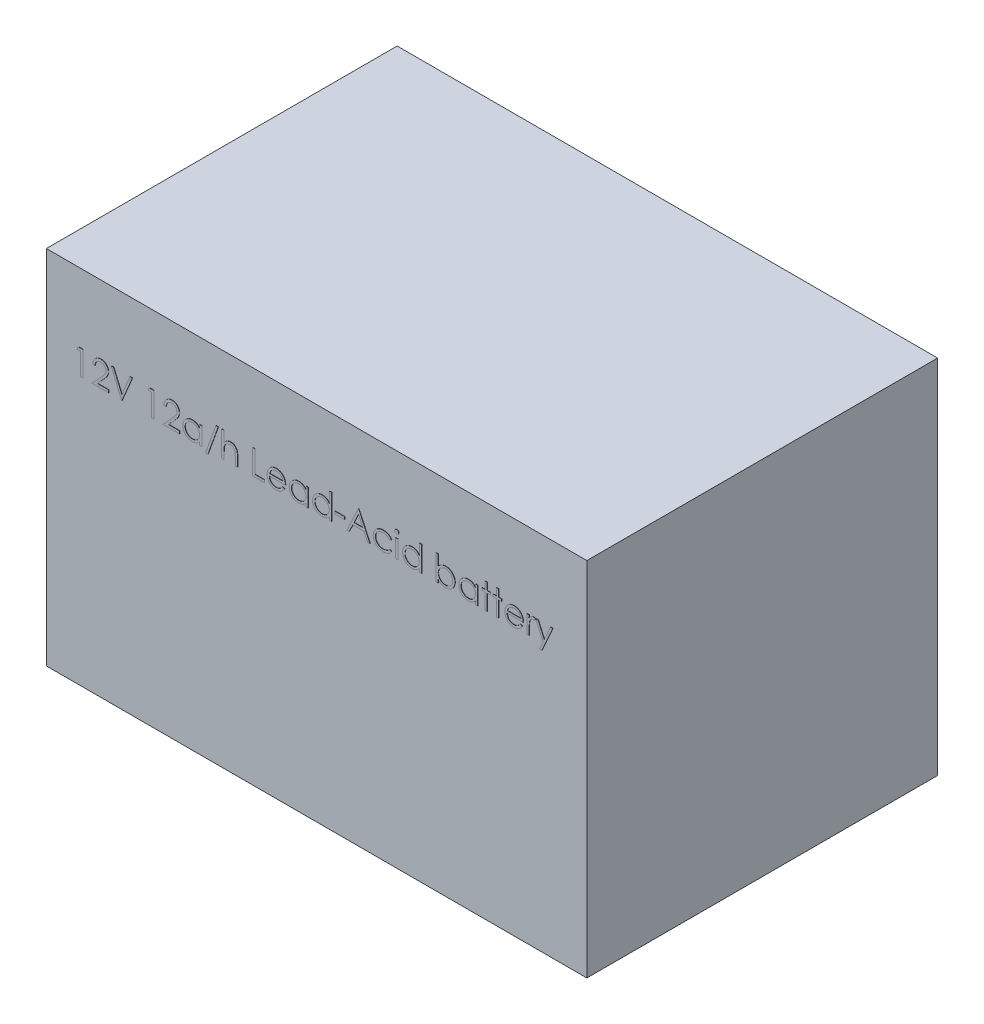
from build123d import *

# Parameters (mm, degrees)
SKETCH1_W           = 151
SKETCH1_H           = 98
BOSS_EXTRUDE1_DEPTH = 101
SKETCH2_W           = 2.645833334
SKETCH2_H           = 0.705555556
SKETCH2_W_2         = 0.617361111
SKETCH2_H_2         = 5.027083333
BOSS_EXTRUDE2_DEPTH = 0.1


with BuildPart() as part:
    # Sketch1 → Boss-Extrude1 (new body)
    with BuildSketch(Plane(origin=(0, 0, 0), x_dir=(1, 0, 0), z_dir=(0, 1, 0))):
        with Locations((45.578534031, -39.693717277)):
            Rectangle(SKETCH1_W, SKETCH1_H)
    extrude(amount=BOSS_EXTRUDE1_DEPTH)

    # Sketch2 → Boss-Extrude2 (add)
    # profile 1 of 25: a face of its own
    with BuildSketch(Plane.XY.offset(88.693717277)):
        Polygon((-20.922839817, 81.744877343), (-19.650910564, 81.744877343), (-19.650910564, 74.865710677), (-20.268271675, 74.865710677), (-20.268271675, 81.039321788), (-21.326605008, 81.039321788), align=None)
    # profile 2 of 25: a face of its own
    with BuildSketch(Plane.XY.offset(88.693717277)):
        with BuildLine():
            Line((-16.21132723, 79.628210677), (-16.828688342, 79.628210677))
            add(Edge.make_bspline(
                [(-16.828688342, 79.628210677), (-16.824664711, 79.710113815), (-16.816762408, 79.870969397), (-16.779755854, 80.105497694), (-16.726804201, 80.329669686), (-16.651936355, 80.541685433), (-16.558956992, 80.743419565), (-16.447455474, 80.934070786), (-16.315387561, 81.112911801), (-16.16560504, 81.278284694), (-16.00292525, 81.429995027), (-15.827396553, 81.56100432), (-15.642946386, 81.671695362), (-15.450134353, 81.764232422), (-15.246785079, 81.833692048), (-15.03474389, 81.885230056), (-14.813079183, 81.916238088), (-14.662051949, 81.919571114), (-14.585242161, 81.921266232)],
                knots=[0, 0, 0, 0, 1.10065271, 2.161652631, 3.183658789, 4.190468796, 5.17591951, 6.163126047, 7.15150782, 8.156236427, 9.156009102, 10.134482811, 11.092018607, 12.041330605, 13.001268258, 13.972401359, 14.968799086, 16, 16, 16, 16], degree=3))
            add(Edge.make_bspline(
                [(-14.585242161, 81.921266232), (-14.50981097, 81.919500338), (-14.361591375, 81.916030417), (-14.145267106, 81.886231775), (-13.939329828, 81.83956038), (-13.744182087, 81.774079723), (-13.561380882, 81.686056997), (-13.389552969, 81.580319216), (-13.226652709, 81.458027619), (-13.080014852, 81.314048992), (-12.945363853, 81.160344068), (-12.829199778, 80.996250581), (-12.72972081, 80.826768973), (-12.64680193, 80.650606877), (-12.585761828, 80.466105605), (-12.539419422, 80.275951282), (-12.513224708, 80.078175612), (-12.509204476, 79.944313798), (-12.507160564, 79.876257552)],
                knots=[0, 0, 0, 0, 1.111607364, 2.184268762, 3.212621178, 4.221274766, 5.211760367, 6.196651075, 7.1921475, 8.207485113, 9.220403448, 10.201281604, 11.166441695, 12.114753415, 13.065576456, 14.026450734, 14.996634279, 16, 16, 16, 16], degree=3))
            add(Edge.make_bspline(
                [(-12.507160564, 79.876257552), (-12.510488632, 79.780444844), (-12.517086364, 79.590500805), (-12.573523788, 79.311373973), (-12.661668538, 79.040937384), (-12.767799057, 78.823285853), (-12.874863349, 78.647899546), (-12.971343676, 78.503498556), (-13.084289394, 78.348018641), (-13.215344394, 78.181980446), (-13.36179767, 78.004083417), (-13.524975756, 77.814435021), (-13.706042266, 77.614994674), (-13.83312701, 77.478776164), (-13.89897914, 77.408191146)],
                knots=[0, 0, 0, 0, 1.184426356, 2.348067706, 3.509069118, 4.696110526, 5.333549288, 6.050745305, 6.844228056, 7.710549037, 8.667450064, 9.695053472, 10.805634456, 12, 12, 12, 12], degree=3))
            Line((-13.89897914, 77.408191146), (-15.620148845, 75.571266232))
            Line((-15.620148845, 75.571266232), (-12.418966119, 75.571266232))
            Line((-12.418966119, 75.571266232), (-12.418966119, 74.865710677))
            Line((-12.418966119, 74.865710677), (-17.093271675, 74.865710677))
            Line((-17.093271675, 74.865710677), (-14.42538973, 77.712737586))
            add(Edge.make_bspline(
                [(-14.42538973, 77.712737586), (-14.360434896, 77.780543187), (-14.235669952, 77.910783868), (-14.059204435, 78.100929852), (-13.900710423, 78.277330438), (-13.759161952, 78.439652332), (-13.63762967, 78.590269854), (-13.529779604, 78.724304921), (-13.443366282, 78.847647299), (-13.349582808, 78.990617243), (-13.258750328, 79.165175738), (-13.180696638, 79.37849612), (-13.13310293, 79.598093375), (-13.127393545, 79.746490831), (-13.124521675, 79.821136024)],
                knots=[0, 0, 0, 0, 1.329631726, 2.553950428, 3.673215718, 4.687767853, 5.603093632, 6.413772471, 7.123043292, 7.734684054, 8.834405432, 9.900288307, 10.943827018, 12, 12, 12, 12], degree=3))
            add(Edge.make_bspline(
                [(-13.124521675, 79.821136024), (-13.125771211, 79.868074344), (-13.128233807, 79.960580759), (-13.149967449, 80.096209935), (-13.18281155, 80.227041492), (-13.229875385, 80.353477861), (-13.29199768, 80.474247828), (-13.367616192, 80.589498399), (-13.454863805, 80.70091921), (-13.555793502, 80.805390752), (-13.666669001, 80.901072502), (-13.78380008, 80.985831865), (-13.907723559, 81.05666588), (-14.037916942, 81.11473292), (-14.174017263, 81.16028358), (-14.316287756, 81.191846335), (-14.464335317, 81.211663217), (-14.565426628, 81.214344465), (-14.616937039, 81.215710677)],
                knots=[0, 0, 0, 0, 0.991446411, 1.95395049, 2.89581595, 3.838931463, 4.798493298, 5.75982156, 6.748411868, 7.785213223, 8.824556874, 9.840280684, 10.836137867, 11.835679398, 12.848801643, 13.863922112, 14.911575587, 16, 16, 16, 16], degree=3))
            add(Edge.make_bspline(
                [(-14.616937039, 81.215710677), (-14.67073376, 81.214305298), (-14.776381635, 81.211545366), (-14.931495115, 81.192239154), (-15.079467519, 81.158932508), (-15.220671068, 81.113379306), (-15.355344683, 81.05547923), (-15.482833417, 80.983362479), (-15.602851072, 80.897307066), (-15.715623263, 80.799739734), (-15.819526155, 80.69111258), (-15.910816383, 80.570019665), (-15.990583297, 80.438671971), (-16.060179302, 80.297423908), (-16.116697926, 80.1449938), (-16.15988563, 79.981922751), (-16.194059064, 79.808918822), (-16.205475573, 79.689447185), (-16.21132723, 79.628210677)],
                knots=[0, 0, 0, 0, 1.031018746, 2.02475058, 2.990194455, 3.934040569, 4.864654155, 5.795059489, 6.735614925, 7.690564532, 8.649604399, 9.611025574, 10.590972636, 11.591080095, 12.624614302, 13.701020113, 14.821632451, 16, 16, 16, 16], degree=3))
        make_face()
    # profile 3 of 25: a face of its own
    with BuildSketch(Plane.XY.offset(88.693717277)):
        Polygon((-11.713410564, 81.744877343), (-11.05195223, 81.744877343), (-8.758896675, 76.323675086), (-6.465841119, 81.744877343), (-5.804382786, 81.744877343), (-8.714799453, 74.865710677), (-8.802993897, 74.865710677), align=None)
    # profile 4 of 25: a face of its own
    with BuildSketch(Plane.XY.offset(88.693717277)):
        Polygon((-1.079089817, 81.744877343), (0.192839436, 81.744877343), (0.192839436, 74.865710677), (-0.424521675, 74.865710677), (-0.424521675, 81.039321788), (-1.482855008, 81.039321788), align=None)
    # profile 5 of 25: a face of its own
    with BuildSketch(Plane.XY.offset(88.693717277)):
        with BuildLine():
            Line((3.63242277, 79.628210677), (3.015061658, 79.628210677))
            add(Edge.make_bspline(
                [(3.015061658, 79.628210677), (3.019085289, 79.710113815), (3.026987592, 79.870969397), (3.063994146, 80.105497694), (3.116945799, 80.329669686), (3.191813645, 80.541685433), (3.284793008, 80.743419565), (3.396294526, 80.934070786), (3.528362439, 81.112911801), (3.67814496, 81.278284694), (3.84082475, 81.429995027), (4.016353447, 81.56100432), (4.200803614, 81.671695362), (4.393615647, 81.764232422), (4.596964921, 81.833692048), (4.80900611, 81.885230056), (5.030670817, 81.916238088), (5.181698051, 81.919571114), (5.258507839, 81.921266232)],
                knots=[0, 0, 0, 0, 1.10065271, 2.161652631, 3.183658789, 4.190468796, 5.17591951, 6.163126047, 7.15150782, 8.156236427, 9.156009102, 10.134482811, 11.092018607, 12.041330605, 13.001268258, 13.972401359, 14.968799086, 16, 16, 16, 16], degree=3))
            add(Edge.make_bspline(
                [(5.258507839, 81.921266232), (5.33393903, 81.919500338), (5.482158625, 81.916030417), (5.698482894, 81.886231775), (5.904420172, 81.83956038), (6.099567913, 81.774079723), (6.282369118, 81.686056997), (6.454197031, 81.580319216), (6.617097291, 81.458027619), (6.763735148, 81.314048992), (6.898386147, 81.160344068), (7.014550222, 80.996250581), (7.11402919, 80.826768973), (7.19694807, 80.650606877), (7.257988172, 80.466105605), (7.304330578, 80.275951282), (7.330525292, 80.078175612), (7.334545524, 79.944313798), (7.336589436, 79.876257552)],
                knots=[0, 0, 0, 0, 1.111607364, 2.184268762, 3.212621178, 4.221274766, 5.211760367, 6.196651075, 7.1921475, 8.207485113, 9.220403448, 10.201281604, 11.166441695, 12.114753415, 13.065576456, 14.026450734, 14.996634279, 16, 16, 16, 16], degree=3))
            add(Edge.make_bspline(
                [(7.336589436, 79.876257552), (7.333261368, 79.780444844), (7.326663636, 79.590500805), (7.270226212, 79.311373973), (7.182081462, 79.040937384), (7.075950943, 78.823285853), (6.968886651, 78.647899546), (6.872406324, 78.503498556), (6.759460606, 78.348018641), (6.628405606, 78.181980446), (6.48195233, 78.004083417), (6.318774244, 77.814435021), (6.137707734, 77.614994674), (6.01062299, 77.478776164), (5.94477086, 77.408191146)],
                knots=[0, 0, 0, 0, 1.184426356, 2.348067706, 3.509069118, 4.696110526, 5.333549288, 6.050745305, 6.844228056, 7.710549037, 8.667450064, 9.695053472, 10.805634456, 12, 12, 12, 12], degree=3))
            Line((5.94477086, 77.408191146), (4.223601155, 75.571266232))
            Line((4.223601155, 75.571266232), (7.424783881, 75.571266232))
            Line((7.424783881, 75.571266232), (7.424783881, 74.865710677))
            Line((7.424783881, 74.865710677), (2.750478325, 74.865710677))
            Line((2.750478325, 74.865710677), (5.41836027, 77.712737586))
            add(Edge.make_bspline(
                [(5.41836027, 77.712737586), (5.483315104, 77.780543187), (5.608080048, 77.910783868), (5.784545565, 78.100929852), (5.943039577, 78.277330438), (6.084588048, 78.439652332), (6.20612033, 78.590269854), (6.313970396, 78.724304921), (6.400383718, 78.847647299), (6.494167192, 78.990617243), (6.584999672, 79.165175738), (6.663053362, 79.37849612), (6.71064707, 79.598093375), (6.716356455, 79.746490831), (6.719228325, 79.821136024)],
                knots=[0, 0, 0, 0, 1.329631726, 2.553950428, 3.673215718, 4.687767853, 5.603093632, 6.413772471, 7.123043292, 7.734684054, 8.834405432, 9.900288307, 10.943827018, 12, 12, 12, 12], degree=3))
            add(Edge.make_bspline(
                [(6.719228325, 79.821136024), (6.717978789, 79.868074344), (6.715516193, 79.960580759), (6.693782551, 80.096209935), (6.66093845, 80.227041492), (6.613874615, 80.353477861), (6.55175232, 80.474247828), (6.476133808, 80.589498399), (6.388886195, 80.70091921), (6.287956498, 80.805390752), (6.177080999, 80.901072502), (6.05994992, 80.985831865), (5.936026441, 81.05666588), (5.805833058, 81.11473292), (5.669732737, 81.16028358), (5.527462244, 81.191846335), (5.379414683, 81.211663217), (5.278323372, 81.214344465), (5.226812961, 81.215710677)],
                knots=[0, 0, 0, 0, 0.991446411, 1.95395049, 2.89581595, 3.838931463, 4.798493298, 5.75982156, 6.748411868, 7.785213223, 8.824556874, 9.840280684, 10.836137867, 11.835679398, 12.848801643, 13.863922112, 14.911575587, 16, 16, 16, 16], degree=3))
            add(Edge.make_bspline(
                [(5.226812961, 81.215710677), (5.17301624, 81.214305298), (5.067368365, 81.211545366), (4.912254885, 81.192239154), (4.764282481, 81.158932508), (4.623078932, 81.113379306), (4.488405317, 81.05547923), (4.360916583, 80.983362479), (4.240898928, 80.897307066), (4.128126737, 80.799739734), (4.024223845, 80.69111258), (3.932933617, 80.570019665), (3.853166703, 80.438671971), (3.783570698, 80.297423908), (3.727052074, 80.1449938), (3.68386437, 79.981922751), (3.649690936, 79.808918822), (3.638274427, 79.689447185), (3.63242277, 79.628210677)],
                knots=[0, 0, 0, 0, 1.031018746, 2.02475058, 2.990194455, 3.934040569, 4.864654155, 5.795059489, 6.735614925, 7.690564532, 8.649604399, 9.611025574, 10.590972636, 11.591080095, 12.624614302, 13.701020113, 14.821632451, 16, 16, 16, 16], degree=3))
        make_face()
    # profile 6 of 25: a face of its own
    with BuildSketch(Plane.XY.offset(88.693717277)):
        with BuildLine():
            Line((13.598394992, 79.89279401), (13.598394992, 74.865710677))
            Line((13.598394992, 74.865710677), (12.981033881, 74.865710677))
            Line((12.981033881, 74.865710677), (12.981033881, 75.735252777))
            add(Edge.make_bspline(
                [(12.981033881, 75.735252777), (12.911419091, 75.656555909), (12.775564954, 75.50297798), (12.548668185, 75.302337901), (12.308156445, 75.136494319), (12.055197062, 75.002547282), (11.790018467, 74.901930514), (11.513208491, 74.830414385), (11.224654217, 74.784434359), (11.027610601, 74.779842963), (10.927756971, 74.777516232)],
                knots=[0, 0, 0, 0, 1.074387032, 2.096679803, 3.090159297, 4.057316773, 5.018401886, 5.985159533, 6.978961417, 8, 8, 8, 8], degree=3))
            add(Edge.make_bspline(
                [(10.927756971, 74.777516232), (10.838980433, 74.779926638), (10.66390917, 74.784680064), (10.406374638, 74.821556925), (10.158543324, 74.880777945), (9.920181039, 74.963133145), (9.692830191, 75.072375927), (9.474544216, 75.203161166), (9.26645396, 75.35890713), (9.071731209, 75.536955743), (8.892416885, 75.730348748), (8.73505836, 75.936616722), (8.603856771, 76.154867726), (8.494143731, 76.382338484), (8.40963544, 76.62078007), (8.350722975, 76.869367933), (8.313889073, 77.127808148), (8.309137612, 77.303795949), (8.306728325, 77.393032725)],
                knots=[0, 0, 0, 0, 1.033919861, 2.038935746, 3.024066025, 3.998881131, 4.97069526, 5.957263378, 6.95902576, 7.993208707, 9.027059324, 10.027763471, 11.009749337, 11.988697705, 12.965288445, 13.950418724, 14.960734635, 16, 16, 16, 16], degree=3))
            add(Edge.make_bspline(
                [(8.306728325, 77.393032725), (8.309191011, 77.480425076), (8.314059607, 77.653195039), (8.350328971, 77.907289242), (8.41131968, 78.152026919), (8.496911937, 78.386620149), (8.60666797, 78.611352795), (8.740179008, 78.826383801), (8.897454692, 79.032305557), (9.078774602, 79.224276028), (9.275194013, 79.401602497), (9.485320578, 79.555713609), (9.70392729, 79.688809463), (9.934404945, 79.794264094), (10.173342195, 79.879583655), (10.42286617, 79.938612739), (10.681938689, 79.973396402), (10.857830121, 79.978433454), (10.947049506, 79.980988455)],
                knots=[0, 0, 0, 0, 1.020392517, 2.01726096, 2.990465484, 3.961182959, 4.928053699, 5.906110375, 6.912531644, 7.948652711, 8.985773172, 9.998621852, 10.987621588, 11.969261332, 12.953316658, 13.946091881, 14.958173133, 16, 16, 16, 16], degree=3))
            add(Edge.make_bspline(
                [(10.947049506, 79.980988455), (11.049647086, 79.978162588), (11.250836098, 79.972621197), (11.545122935, 79.926505766), (11.823521784, 79.848597302), (12.088181707, 79.742623743), (12.338152318, 79.601799872), (12.571067112, 79.424160211), (12.789363675, 79.210825092), (12.915901605, 79.046962469), (12.981033881, 78.962618229)],
                knots=[0, 0, 0, 0, 1.038897134, 2.037228247, 3.008116434, 3.962042015, 4.918381754, 5.904844433, 6.921570401, 8, 8, 8, 8], degree=3))
            Line((12.981033881, 78.962618229), (12.981033881, 79.89279401))
            Line((12.981033881, 79.89279401), (13.598394992, 79.89279401))
        make_face()
        with BuildLine():
            add(Edge.make_bspline(
                [(10.955317735, 79.363627343), (10.865074197, 79.360416467), (10.686947807, 79.354078709), (10.425452989, 79.304600803), (10.175221505, 79.22227763), (9.937504875, 79.109691417), (9.716058178, 78.968120651), (9.518147165, 78.796885646), (9.342153118, 78.600658372), (9.194136518, 78.380324343), (9.073474958, 78.144117166), (8.988631184, 77.897205324), (8.932675556, 77.644042208), (8.926958928, 77.472332929), (8.924089436, 77.386142534)],
                knots=[0, 0, 0, 0, 1.031046209, 2.035121221, 3.029706178, 4.034933723, 5.034054252, 6.02443088, 7.017295772, 8.038157696, 9.050218397, 10.03989886, 11.016116709, 12, 12, 12, 12], degree=3))
            add(Edge.make_bspline(
                [(8.924089436, 77.386142534), (8.92775484, 77.300467217), (8.935071279, 77.129452399), (8.987649132, 76.875944147), (9.075859455, 76.628974119), (9.196229271, 76.390638523), (9.346955006, 76.169357154), (9.521663536, 75.969389366), (9.722044387, 75.797430663), (9.944000713, 75.653483956), (10.181052807, 75.53720143), (10.43034188, 75.456291346), (10.687181735, 75.404053351), (10.861818882, 75.397951575), (10.949805582, 75.394877343)],
                knots=[0, 0, 0, 0, 0.979072187, 1.954306742, 2.945804271, 3.96968567, 4.997920485, 5.998718438, 6.996577872, 8.005894225, 9.015743152, 10.005417472, 10.995077863, 12, 12, 12, 12], degree=3))
            add(Edge.make_bspline(
                [(10.949805582, 75.394877343), (11.039129601, 75.398139963), (11.216786216, 75.40462899), (11.479056819, 75.454318715), (11.733576085, 75.536414293), (11.976876935, 75.650213648), (12.203528045, 75.791251023), (12.40695066, 75.95636496), (12.578961212, 76.148398242), (12.724785019, 76.359444104), (12.839127416, 76.590804231), (12.922416551, 76.837145598), (12.971659407, 77.098476783), (12.977865849, 77.277067668), (12.981033881, 77.368228038)],
                knots=[0, 0, 0, 0, 1.01762866, 2.023962475, 3.030623092, 4.058876274, 5.077231937, 6.066672613, 7.034107872, 8.005628644, 8.981990164, 9.965428785, 10.961468474, 12, 12, 12, 12], degree=3))
            add(Edge.make_bspline(
                [(12.981033881, 77.368228038), (12.979147699, 77.437683702), (12.975435096, 77.57439443), (12.947072155, 77.775123634), (12.901954794, 77.967216945), (12.838379167, 78.150876326), (12.754863559, 78.325086338), (12.654137296, 78.491097848), (12.534429084, 78.648047434), (12.397665952, 78.793773874), (12.24796506, 78.926692076), (12.089558409, 79.045336554), (11.920569229, 79.142802106), (11.743839434, 79.223467748), (11.559062394, 79.287658529), (11.364734545, 79.330481723), (11.162921441, 79.359885878), (11.025247587, 79.362367057), (10.955317735, 79.363627343)],
                knots=[0, 0, 0, 0, 1.050140795, 2.067009409, 3.05949893, 4.030605086, 5.00011959, 5.97591094, 6.962425594, 7.979863591, 8.993523472, 9.986985069, 10.967611495, 11.937549037, 12.921786183, 13.919465291, 14.943216303, 16, 16, 16, 16], degree=3))
        make_face(mode=Mode.SUBTRACT)
    # profile 7 of 25: a face of its own
    with BuildSketch(Plane.XY.offset(88.693717277)):
        Polygon((18.184506103, 81.921266232), (15.307162353, 73.895571788), (14.656728325, 73.895571788), (17.534072075, 81.921266232), align=None)
    # profile 8 of 25: a face of its own
    with BuildSketch(Plane.XY.offset(88.693717277)):
        with BuildLine():
            Line((19.154644992, 81.921266232), (19.772006103, 81.921266232))
            Line((19.772006103, 81.921266232), (19.772006103, 78.943325694))
            add(Edge.make_bspline(
                [(19.772006103, 78.943325694), (19.838276656, 79.026158687), (19.96730882, 79.18743877), (20.184486306, 79.397864992), (20.407510604, 79.580258472), (20.644084772, 79.725449097), (20.889868592, 79.840147493), (21.145898684, 79.921493927), (21.412222617, 79.971517452), (21.593095858, 79.977803866), (21.684723117, 79.980988455)],
                knots=[0, 0, 0, 0, 1.125788106, 2.19196713, 3.20547328, 4.180437432, 5.132270164, 6.079753143, 7.027236121, 8, 8, 8, 8], degree=3))
            add(Edge.make_bspline(
                [(21.684723117, 79.980988455), (21.777749877, 79.977557853), (21.959825686, 79.970843338), (22.224931989, 79.917749181), (22.47250509, 79.827027835), (22.701809026, 79.702874551), (22.907839473, 79.548244983), (23.090333473, 79.369717788), (23.239396758, 79.162804408), (23.340813594, 78.971649556), (23.406801327, 78.801559696), (23.448571286, 78.655649599), (23.483987591, 78.493061648), (23.514845048, 78.313879537), (23.535410969, 78.117243135), (23.551930045, 77.90403957), (23.563676624, 77.674281068), (23.564131837, 77.515234244), (23.564367214, 77.432995833)],
                knots=[0, 0, 0, 0, 1.235656852, 2.418478516, 3.575258207, 4.727955599, 5.870717718, 6.98870536, 8.107142894, 9.245821548, 9.854588956, 10.528768408, 11.260415777, 12.065282286, 12.943670737, 13.886611085, 14.907229059, 16, 16, 16, 16], degree=3))
            Line((23.564367214, 77.432995833), (23.564367214, 74.865710677))
            Line((23.564367214, 74.865710677), (22.947006103, 74.865710677))
            Line((22.947006103, 74.865710677), (22.947006103, 77.230424218))
            add(Edge.make_bspline(
                [(22.947006103, 77.230424218), (22.946632067, 77.298867346), (22.945916599, 77.429787402), (22.943551454, 77.617227217), (22.938271761, 77.78723331), (22.929739971, 77.939260833), (22.920766969, 78.073521732), (22.908417258, 78.189821031), (22.894049167, 78.288318463), (22.881138384, 78.347606322), (22.875348117, 78.37419592)],
                knots=[0, 0, 0, 0, 1.430932559, 2.737130458, 3.918967929, 4.986496826, 5.920444988, 6.731744033, 7.431208747, 8, 8, 8, 8], degree=3))
            add(Edge.make_bspline(
                [(22.875348117, 78.37419592), (22.852894035, 78.45221405), (22.809726194, 78.602203451), (22.70939261, 78.80594945), (22.584075792, 78.979667553), (22.431068853, 79.121013374), (22.253078544, 79.231888912), (22.048944258, 79.308675707), (21.820587237, 79.356334028), (21.659710118, 79.36112842), (21.575858099, 79.363627343)],
                knots=[0, 0, 0, 0, 1.090059168, 2.095632401, 3.037101401, 3.955032261, 4.878929692, 5.839099886, 6.873700383, 8, 8, 8, 8], degree=3))
            add(Edge.make_bspline(
                [(21.575858099, 79.363627343), (21.526194893, 79.362692118), (21.42791269, 79.360841331), (21.282175253, 79.342259919), (21.140800391, 79.31189583), (21.002426587, 79.270808457), (20.869986516, 79.214899433), (20.739619773, 79.15017593), (20.615019964, 79.070951014), (20.493974508, 78.982060845), (20.381318261, 78.883649924), (20.276505085, 78.779780493), (20.183069609, 78.66917339), (20.098419319, 78.553603162), (20.025346284, 78.431484601), (19.961560524, 78.303995328), (19.907439768, 78.170967682), (19.880546762, 78.078639317), (19.867090738, 78.032442448)],
                knots=[0, 0, 0, 0, 1.024319606, 2.027102035, 3.025350316, 4.005802111, 5.00026367, 5.987881639, 7.005602596, 8.042517216, 9.083927026, 10.089214625, 11.084353441, 12.06828073, 13.041928858, 14.016821737, 15.00770877, 16, 16, 16, 16], degree=3))
            add(Edge.make_bspline(
                [(19.867090738, 78.032442448), (19.859347888, 77.998988174), (19.842475264, 77.926087194), (19.824167181, 77.805850516), (19.80777944, 77.666131945), (19.793925683, 77.507143396), (19.78542876, 77.328302276), (19.776273099, 77.130828998), (19.772864935, 76.9134866), (19.772300936, 76.762350311), (19.772006103, 76.683343055)],
                knots=[0, 0, 0, 0, 0.607992626, 1.324890765, 2.152360218, 3.099583803, 4.150613268, 5.323148443, 6.60066238, 8, 8, 8, 8], degree=3))
            Line((19.772006103, 76.683343055), (19.772006103, 74.865710677))
            Line((19.772006103, 74.865710677), (19.154644992, 74.865710677))
            Line((19.154644992, 74.865710677), (19.154644992, 81.921266232))
        make_face()
    # profile 9 of 25: a face of its own
    with BuildSketch(Plane.XY.offset(88.693717277)):
        Polygon((27.797700547, 81.744877343), (28.415061658, 81.744877343), (28.415061658, 75.571266232), (31.060894992, 75.571266232), (31.060894992, 74.865710677), (27.797700547, 74.865710677), align=None)
    # profile 10 of 25: a face of its own
    with BuildSketch(Plane.XY.offset(88.693717277)):
        with BuildLine():
            Line((36.156880235, 76.453210677), (36.705339436, 76.165200694))
            add(Edge.make_bspline(
                [(36.705339436, 76.165200694), (36.661633938, 76.087675766), (36.576600345, 75.936842955), (36.430367447, 75.729619144), (36.277075885, 75.543198217), (36.109806062, 75.382560527), (35.933562443, 75.242517626), (35.747367666, 75.119994116), (35.550252382, 75.015590929), (35.342207269, 74.927630901), (35.121485175, 74.85999986), (34.887551218, 74.812230492), (34.639957243, 74.782702615), (34.470245882, 74.779272583), (34.383345079, 74.777516232)],
                knots=[0, 0, 0, 0, 1.120438281, 2.179929193, 3.190490725, 4.156257408, 5.095198341, 6.022838206, 6.959905092, 7.901321166, 8.864066838, 9.862729781, 10.905609505, 12, 12, 12, 12], degree=3))
            add(Edge.make_bspline(
                [(34.383345079, 74.777516232), (34.286757692, 74.779770978), (34.098343682, 74.784169334), (33.824081631, 74.822088213), (33.565858512, 74.883946385), (33.323688843, 74.97035961), (33.098165677, 75.083231648), (32.888840783, 75.220735344), (32.694613358, 75.382164335), (32.521603871, 75.568916893), (32.365851906, 75.768770359), (32.228414372, 75.977024127), (32.113517683, 76.193154226), (32.02005416, 76.415784744), (31.944570312, 76.643512469), (31.891960993, 76.878409413), (31.861634191, 77.119839829), (31.856986929, 77.283165664), (31.854644992, 77.365471961)],
                knots=[0, 0, 0, 0, 1.145258523, 2.234067595, 3.276747158, 4.290159414, 5.277019952, 6.260822364, 7.254936242, 8.264827045, 9.274100331, 10.257902744, 11.220704747, 12.172965371, 13.118907548, 14.062713208, 15.023725156, 16, 16, 16, 16], degree=3))
            add(Edge.make_bspline(
                [(31.854644992, 77.365471961), (31.856726709, 77.442705015), (31.860852397, 77.595770728), (31.886857195, 77.822322411), (31.932944256, 78.042511668), (31.996186055, 78.256521458), (32.07785404, 78.463993457), (32.177763557, 78.665053934), (32.296070242, 78.859488941), (32.387411176, 78.982140815), (32.433421033, 79.043922482)],
                knots=[0, 0, 0, 0, 1.024358464, 2.0301432, 3.019427413, 4.004406732, 4.986367066, 5.972626655, 6.978780325, 8, 8, 8, 8], degree=3))
            add(Edge.make_bspline(
                [(32.433421033, 79.043922482), (32.495741729, 79.118352845), (32.618408959, 79.264855805), (32.825877462, 79.457351252), (33.050531776, 79.618606339), (33.289556532, 79.752272746), (33.545729768, 79.853836069), (33.815607911, 79.929521805), (34.102263938, 79.971932872), (34.298232175, 79.977923316), (34.398503499, 79.980988455)],
                knots=[0, 0, 0, 0, 1.030682036, 2.02871468, 2.997146059, 3.962720338, 4.930598197, 5.918074684, 6.934738563, 8, 8, 8, 8], degree=3))
            add(Edge.make_bspline(
                [(34.398503499, 79.980988455), (34.501588018, 79.978327104), (34.703816347, 79.97310614), (34.998700909, 79.924703668), (35.277721317, 79.847946802), (35.540765918, 79.73954334), (35.78786138, 79.599680935), (36.017401579, 79.426440244), (36.233312112, 79.225139932), (36.358922902, 79.070332719), (36.422841606, 78.991557031)],
                knots=[0, 0, 0, 0, 1.056321875, 2.072262726, 3.055038591, 4.01806755, 4.982017516, 5.957941055, 6.960871419, 8, 8, 8, 8], degree=3))
            add(Edge.make_bspline(
                [(36.422841606, 78.991557031), (36.466331577, 78.932192611), (36.553022035, 78.813858918), (36.661608895, 78.620905846), (36.755868013, 78.419030618), (36.831210535, 78.204970023), (36.892217936, 77.981260348), (36.936356278, 77.746302322), (36.96224085, 77.500165913), (36.967328873, 77.3324586), (36.96992277, 77.246960677)],
                knots=[0, 0, 0, 0, 0.94817472, 1.890038105, 2.849395472, 3.817997239, 4.812318967, 5.836947057, 6.897266129, 8, 8, 8, 8], degree=3))
            Line((36.96992277, 77.246960677), (32.472006103, 77.246960677))
            add(Edge.make_bspline(
                [(32.472006103, 77.246960677), (32.475032163, 77.180723217), (32.480982787, 77.050469923), (32.508725765, 76.859876158), (32.5524552, 76.678318553), (32.613913798, 76.507158907), (32.688340181, 76.344161716), (32.779510203, 76.190536094), (32.888278779, 76.046981781), (33.009599171, 75.912214705), (33.144641331, 75.792201232), (33.28671135, 75.684784467), (33.437843821, 75.594754658), (33.596847078, 75.52167847), (33.763464003, 75.464470698), (33.937747091, 75.42542097), (34.119353389, 75.399266168), (34.24315035, 75.396357921), (34.30617494, 75.394877343)],
                knots=[0, 0, 0, 0, 1.094153842, 2.151609401, 3.174256925, 4.172055639, 5.149267565, 6.128595816, 7.11444997, 8.118368179, 9.117203808, 10.09244225, 11.054858984, 12.015122123, 12.976791628, 13.957293641, 14.960065497, 16, 16, 16, 16], degree=3))
            add(Edge.make_bspline(
                [(34.30617494, 75.394877343), (34.367794874, 75.396072464), (34.490060644, 75.398443813), (34.672144043, 75.421502605), (34.851276614, 75.45878823), (35.026716952, 75.509674389), (35.194904412, 75.57173794), (35.350659654, 75.6466282), (35.493903982, 75.729472523), (35.627786258, 75.824227492), (35.757647223, 75.940206678), (35.886469419, 76.084935935), (36.024596508, 76.256104397), (36.111057005, 76.384932843), (36.156880235, 76.453210677)],
                knots=[0, 0, 0, 0, 0.99110716, 1.966546729, 2.947904876, 3.932708344, 4.903319531, 5.828989031, 6.710028674, 7.56322171, 8.463672341, 9.504779593, 10.677557249, 12, 12, 12, 12], degree=3))
        make_face()
        with BuildLine():
            add(Edge.make_bspline(
                [(36.352561658, 77.864321788), (36.329965317, 77.946209174), (36.286474632, 78.103816033), (36.195598159, 78.32206426), (36.093252785, 78.516032979), (35.97213674, 78.68423771), (35.834909697, 78.833620806), (35.67640351, 78.964164953), (35.498653915, 79.080948539), (35.302579699, 79.179522082), (35.094943286, 79.263427983), (34.877549449, 79.319689967), (34.655730154, 79.358232055), (34.505696932, 79.361821228), (34.430198377, 79.363627343)],
                knots=[0, 0, 0, 0, 1.154881502, 2.222775134, 3.210006277, 4.132804581, 5.035138423, 5.962687519, 6.919655026, 7.923214229, 8.944639381, 9.960483929, 10.97369054, 12, 12, 12, 12], degree=3))
            add(Edge.make_bspline(
                [(34.430198377, 79.363627343), (34.368581802, 79.362425118), (34.246778788, 79.36004857), (34.067328712, 79.337504304), (33.894996351, 79.30023918), (33.728510125, 79.249205676), (33.570051728, 79.181183292), (33.416361773, 79.101417926), (33.271348161, 79.004045123), (33.180658543, 78.929830993), (33.134842474, 78.892338281)],
                knots=[0, 0, 0, 0, 1.04873581, 2.073130211, 3.073294108, 4.04793562, 5.032784715, 6.005352987, 6.992311501, 8, 8, 8, 8], degree=3))
            add(Edge.make_bspline(
                [(33.134842474, 78.892338281), (33.102032226, 78.862670763), (33.03563228, 78.802630937), (32.94690966, 78.699189485), (32.86196085, 78.587645641), (32.784651492, 78.463731949), (32.713741855, 78.328859442), (32.647387423, 78.184165733), (32.587663654, 78.02855283), (32.554061657, 77.920112714), (32.536773898, 77.864321788)],
                knots=[0, 0, 0, 0, 0.879870761, 1.780643979, 2.707998968, 3.669668524, 4.684282772, 5.740141944, 6.837334558, 8, 8, 8, 8], degree=3))
            Line((32.536773898, 77.864321788), (36.352561658, 77.864321788))
        make_face(mode=Mode.SUBTRACT)
    # profile 11 of 25: a face of its own
    with BuildSketch(Plane.XY.offset(88.693717277)):
        with BuildLine():
            Line((43.31992277, 79.89279401), (43.31992277, 74.865710677))
            Line((43.31992277, 74.865710677), (42.702561658, 74.865710677))
            Line((42.702561658, 74.865710677), (42.702561658, 75.735252777))
            add(Edge.make_bspline(
                [(42.702561658, 75.735252777), (42.632946869, 75.656555909), (42.497092731, 75.50297798), (42.270195963, 75.302337901), (42.029684222, 75.136494319), (41.77672484, 75.002547282), (41.511546245, 74.901930514), (41.234736269, 74.830414385), (40.946181995, 74.784434359), (40.749138379, 74.779842963), (40.649284749, 74.777516232)],
                knots=[0, 0, 0, 0, 1.074387032, 2.096679803, 3.090159297, 4.057316773, 5.018401886, 5.985159533, 6.978961417, 8, 8, 8, 8], degree=3))
            add(Edge.make_bspline(
                [(40.649284749, 74.777516232), (40.560508211, 74.779926638), (40.385436947, 74.784680064), (40.127902416, 74.821556925), (39.880071102, 74.880777945), (39.641708817, 74.963133145), (39.414357969, 75.072375927), (39.196071993, 75.203161166), (38.987981738, 75.35890713), (38.793258987, 75.536955743), (38.613944663, 75.730348748), (38.456586137, 75.936616722), (38.325384548, 76.154867726), (38.215671509, 76.382338484), (38.131163217, 76.62078007), (38.072250753, 76.869367933), (38.035416851, 77.127808148), (38.03066539, 77.303795949), (38.028256103, 77.393032725)],
                knots=[0, 0, 0, 0, 1.033919861, 2.038935746, 3.024066025, 3.998881131, 4.97069526, 5.957263378, 6.95902576, 7.993208707, 9.027059324, 10.027763471, 11.009749337, 11.988697705, 12.965288445, 13.950418724, 14.960734635, 16, 16, 16, 16], degree=3))
            add(Edge.make_bspline(
                [(38.028256103, 77.393032725), (38.030718788, 77.480425076), (38.035587385, 77.653195039), (38.071856749, 77.907289242), (38.132847457, 78.152026919), (38.218439715, 78.386620149), (38.328195748, 78.611352795), (38.461706786, 78.826383801), (38.61898247, 79.032305557), (38.80030238, 79.224276028), (38.996721791, 79.401602497), (39.206848356, 79.555713609), (39.425455067, 79.688809463), (39.655932723, 79.794264094), (39.894869973, 79.879583655), (40.144393948, 79.938612739), (40.403466467, 79.973396402), (40.579357899, 79.978433454), (40.668577283, 79.980988455)],
                knots=[0, 0, 0, 0, 1.020392517, 2.01726096, 2.990465484, 3.961182959, 4.928053699, 5.906110375, 6.912531644, 7.948652711, 8.985773172, 9.998621852, 10.987621588, 11.969261332, 12.953316658, 13.946091881, 14.958173133, 16, 16, 16, 16], degree=3))
            add(Edge.make_bspline(
                [(40.668577283, 79.980988455), (40.771174864, 79.978162588), (40.972363876, 79.972621197), (41.266650713, 79.926505766), (41.545049562, 79.848597302), (41.809709485, 79.742623743), (42.059680095, 79.601799872), (42.29259489, 79.424160211), (42.510891453, 79.210825092), (42.637429383, 79.046962469), (42.702561658, 78.962618229)],
                knots=[0, 0, 0, 0, 1.038897134, 2.037228247, 3.008116434, 3.962042015, 4.918381754, 5.904844433, 6.921570401, 8, 8, 8, 8], degree=3))
            Line((42.702561658, 78.962618229), (42.702561658, 79.89279401))
            Line((42.702561658, 79.89279401), (43.31992277, 79.89279401))
        make_face()
        with BuildLine():
            add(Edge.make_bspline(
                [(40.676845513, 79.363627343), (40.586601975, 79.360416467), (40.408475585, 79.354078709), (40.146980766, 79.304600803), (39.896749282, 79.22227763), (39.659032653, 79.109691417), (39.437585956, 78.968120651), (39.239674943, 78.796885646), (39.063680896, 78.600658372), (38.915664295, 78.380324343), (38.795002735, 78.144117166), (38.710158962, 77.897205324), (38.654203334, 77.644042208), (38.648486706, 77.472332929), (38.645617214, 77.386142534)],
                knots=[0, 0, 0, 0, 1.031046209, 2.035121221, 3.029706178, 4.034933723, 5.034054252, 6.02443088, 7.017295772, 8.038157696, 9.050218397, 10.03989886, 11.016116709, 12, 12, 12, 12], degree=3))
            add(Edge.make_bspline(
                [(38.645617214, 77.386142534), (38.649282617, 77.300467217), (38.656599057, 77.129452399), (38.70917691, 76.875944147), (38.797387233, 76.628974119), (38.917757049, 76.390638523), (39.068482784, 76.169357154), (39.243191314, 75.969389366), (39.443572165, 75.797430663), (39.665528491, 75.653483956), (39.902580585, 75.53720143), (40.151869658, 75.456291346), (40.408709513, 75.404053351), (40.58334666, 75.397951575), (40.67133336, 75.394877343)],
                knots=[0, 0, 0, 0, 0.979072187, 1.954306742, 2.945804271, 3.96968567, 4.997920485, 5.998718438, 6.996577872, 8.005894225, 9.015743152, 10.005417472, 10.995077863, 12, 12, 12, 12], degree=3))
            add(Edge.make_bspline(
                [(40.67133336, 75.394877343), (40.760657379, 75.398139963), (40.938313994, 75.40462899), (41.200584597, 75.454318715), (41.455103863, 75.536414293), (41.698404713, 75.650213648), (41.925055823, 75.791251023), (42.128478437, 75.95636496), (42.30048899, 76.148398242), (42.446312797, 76.359444104), (42.560655194, 76.590804231), (42.643944329, 76.837145598), (42.693187184, 77.098476783), (42.699393627, 77.277067668), (42.702561658, 77.368228038)],
                knots=[0, 0, 0, 0, 1.01762866, 2.023962475, 3.030623092, 4.058876274, 5.077231937, 6.066672613, 7.034107872, 8.005628644, 8.981990164, 9.965428785, 10.961468474, 12, 12, 12, 12], degree=3))
            add(Edge.make_bspline(
                [(42.702561658, 77.368228038), (42.700675477, 77.437683702), (42.696962874, 77.57439443), (42.668599933, 77.775123634), (42.623482572, 77.967216945), (42.559906945, 78.150876326), (42.476391337, 78.325086338), (42.375665073, 78.491097848), (42.255956862, 78.648047434), (42.11919373, 78.793773874), (41.969492838, 78.926692076), (41.811086187, 79.045336554), (41.642097007, 79.142802106), (41.465367212, 79.223467748), (41.280590172, 79.287658529), (41.086262323, 79.330481723), (40.884449219, 79.359885878), (40.746775365, 79.362367057), (40.676845513, 79.363627343)],
                knots=[0, 0, 0, 0, 1.050140795, 2.067009409, 3.05949893, 4.030605086, 5.00011959, 5.97591094, 6.962425594, 7.979863591, 8.993523472, 9.986985069, 10.967611495, 11.937549037, 12.921786183, 13.919465291, 14.943216303, 16, 16, 16, 16], degree=3))
        make_face(mode=Mode.SUBTRACT)
    # profile 12 of 25: a face of its own
    with BuildSketch(Plane.XY.offset(88.693717277)):
        with BuildLine():
            Line((49.846311658, 81.921266232), (49.846311658, 74.865710677))
            Line((49.846311658, 74.865710677), (49.228950547, 74.865710677))
            Line((49.228950547, 74.865710677), (49.228950547, 75.735252777))
            add(Edge.make_bspline(
                [(49.228950547, 75.735252777), (49.159335758, 75.656555909), (49.02348162, 75.50297798), (48.796584851, 75.302337901), (48.556073111, 75.136494319), (48.303113729, 75.002547282), (48.037935134, 74.901930514), (47.761125158, 74.830414385), (47.472570884, 74.784434359), (47.275527268, 74.779842963), (47.175673638, 74.777516232)],
                knots=[0, 0, 0, 0, 1.074387032, 2.096679803, 3.090159297, 4.057316773, 5.018401886, 5.985159533, 6.978961417, 8, 8, 8, 8], degree=3))
            add(Edge.make_bspline(
                [(47.175673638, 74.777516232), (47.0868971, 74.779926638), (46.911825836, 74.784680064), (46.654291305, 74.821556925), (46.406459991, 74.880777945), (46.168097706, 74.963133145), (45.940746858, 75.072375927), (45.722460882, 75.203161166), (45.514370627, 75.35890713), (45.319647876, 75.536955743), (45.140333551, 75.730348748), (44.982975026, 75.936616722), (44.851773437, 76.154867726), (44.742060398, 76.382338484), (44.657552106, 76.62078007), (44.598639642, 76.869367933), (44.56180574, 77.127808148), (44.557054279, 77.303795949), (44.554644992, 77.393032725)],
                knots=[0, 0, 0, 0, 1.033919861, 2.038935746, 3.024066025, 3.998881131, 4.97069526, 5.957263378, 6.95902576, 7.993208707, 9.027059324, 10.027763471, 11.009749337, 11.988697705, 12.965288445, 13.950418724, 14.960734635, 16, 16, 16, 16], degree=3))
            add(Edge.make_bspline(
                [(44.554644992, 77.393032725), (44.557107677, 77.480425076), (44.561976273, 77.653195039), (44.598245638, 77.907289242), (44.659236346, 78.152026919), (44.744828604, 78.386620149), (44.854584637, 78.611352795), (44.988095675, 78.826383801), (45.145371359, 79.032305557), (45.326691269, 79.224276028), (45.52311068, 79.401602497), (45.733237245, 79.555713609), (45.951843956, 79.688809463), (46.182321612, 79.794264094), (46.421258862, 79.879583655), (46.670782837, 79.938612739), (46.929855356, 79.973396402), (47.105746787, 79.978433454), (47.194966172, 79.980988455)],
                knots=[0, 0, 0, 0, 1.020392517, 2.01726096, 2.990465484, 3.961182959, 4.928053699, 5.906110375, 6.912531644, 7.948652711, 8.985773172, 9.998621852, 10.987621588, 11.969261332, 12.953316658, 13.946091881, 14.958173133, 16, 16, 16, 16], degree=3))
            add(Edge.make_bspline(
                [(47.194966172, 79.980988455), (47.297597065, 79.977908365), (47.499050101, 79.97186249), (47.793672076, 79.921337238), (48.072352248, 79.836501629), (48.336695013, 79.720359123), (48.585124443, 79.569409075), (48.819461566, 79.387108312), (49.035631169, 79.168297457), (49.163528287, 79.003960901), (49.228950547, 78.919899045)],
                knots=[0, 0, 0, 0, 1.031072012, 2.023879775, 2.993683497, 3.952812103, 4.918022106, 5.908088563, 6.929940113, 8, 8, 8, 8], degree=3))
            Line((49.228950547, 78.919899045), (49.228950547, 81.921266232))
            Line((49.228950547, 81.921266232), (49.846311658, 81.921266232))
        make_face()
        with BuildLine():
            add(Edge.make_bspline(
                [(47.203234401, 79.363627343), (47.112990864, 79.360416467), (46.934864474, 79.354078709), (46.673369655, 79.304600803), (46.423138171, 79.22227763), (46.185421542, 79.109691417), (45.963974845, 78.968120651), (45.766063832, 78.796885646), (45.590069785, 78.600658372), (45.442053184, 78.380324343), (45.321391624, 78.144117166), (45.236547851, 77.897205324), (45.180592223, 77.644042208), (45.174875595, 77.472332929), (45.172006103, 77.386142534)],
                knots=[0, 0, 0, 0, 1.031046209, 2.035121221, 3.029706178, 4.034933723, 5.034054252, 6.02443088, 7.017295772, 8.038157696, 9.050218397, 10.03989886, 11.016116709, 12, 12, 12, 12], degree=3))
            add(Edge.make_bspline(
                [(45.172006103, 77.386142534), (45.175671506, 77.300467217), (45.182987946, 77.129452399), (45.235565799, 76.875944147), (45.323776122, 76.628974119), (45.444145938, 76.390638523), (45.594871673, 76.169357154), (45.769580203, 75.969389366), (45.969961053, 75.797430663), (46.19191738, 75.653483956), (46.428969474, 75.53720143), (46.678258546, 75.456291346), (46.935098402, 75.404053351), (47.109735549, 75.397951575), (47.197722249, 75.394877343)],
                knots=[0, 0, 0, 0, 0.979072187, 1.954306742, 2.945804271, 3.96968567, 4.997920485, 5.998718438, 6.996577872, 8.005894225, 9.015743152, 10.005417472, 10.995077863, 12, 12, 12, 12], degree=3))
            add(Edge.make_bspline(
                [(47.197722249, 75.394877343), (47.287046268, 75.398139963), (47.464702883, 75.40462899), (47.726973486, 75.454318715), (47.981492752, 75.536414293), (48.224793602, 75.650213648), (48.451444712, 75.791251023), (48.654867326, 75.95636496), (48.826877878, 76.148398242), (48.972701686, 76.359444104), (49.087044083, 76.590804231), (49.170333218, 76.837145598), (49.219576073, 77.098476783), (49.225782516, 77.277067668), (49.228950547, 77.368228038)],
                knots=[0, 0, 0, 0, 1.01762866, 2.023962475, 3.030623092, 4.058876274, 5.077231937, 6.066672613, 7.034107872, 8.005628644, 8.981990164, 9.965428785, 10.961468474, 12, 12, 12, 12], degree=3))
            add(Edge.make_bspline(
                [(49.228950547, 77.368228038), (49.227064366, 77.437683702), (49.223351763, 77.57439443), (49.194988822, 77.775123634), (49.149871461, 77.967216945), (49.086295834, 78.150876326), (49.002780226, 78.325086338), (48.902053962, 78.491097848), (48.782345751, 78.648047434), (48.645582619, 78.793773874), (48.495881726, 78.926692076), (48.337475076, 79.045336554), (48.168485896, 79.142802106), (47.991756101, 79.223467748), (47.806979061, 79.287658529), (47.612651212, 79.330481723), (47.410838108, 79.359885878), (47.273164254, 79.362367057), (47.203234401, 79.363627343)],
                knots=[0, 0, 0, 0, 1.050140795, 2.067009409, 3.05949893, 4.030605086, 5.00011959, 5.97591094, 6.962425594, 7.979863591, 8.993523472, 9.986985069, 10.967611495, 11.937549037, 12.921786183, 13.919465291, 14.943216303, 16, 16, 16, 16], degree=3))
        make_face(mode=Mode.SUBTRACT)
    # profile 13 of 25: a face of its own
    with BuildSketch(Plane.XY.offset(88.693717277)):
        with Locations((52.139367214, 77.51154401)):
            Rectangle(SKETCH2_W, SKETCH2_H)
    # profile 14 of 25: a face of its own
    with BuildSketch(Plane.XY.offset(88.693717277)):
        Polygon((57.431033881, 81.744877343), (60.606033881, 74.865710677), (59.93492928, 74.865710677), (58.917937092, 77.070571788), (55.799436658, 77.070571788), (54.753505669, 74.865710677), (54.079644992, 74.865710677), (57.342839436, 81.744877343), align=None)
        Polygon((57.380046467, 80.40404618), (56.13429994, 77.776127343), (58.592720079, 77.776127343), align=None, mode=Mode.SUBTRACT)
    # profile 15 of 25: a face of its own
    with BuildSketch(Plane.XY.offset(88.693717277)):
        with BuildLine():
            Line((66.603256103, 78.802765798), (66.08649178, 78.481682899))
            add(Edge.make_bspline(
                [(66.08649178, 78.481682899), (66.029827366, 78.552102754), (65.918293088, 78.690712283), (65.724616565, 78.86959014), (65.51821913, 79.023225599), (65.295573825, 79.148433805), (65.056992925, 79.245177394), (64.803417306, 79.313635333), (64.53488313, 79.356294506), (64.350786411, 79.361143015), (64.256457058, 79.363627343)],
                knots=[0, 0, 0, 0, 1.026593902, 2.0206758, 2.988051866, 3.946915611, 4.916868779, 5.907761954, 6.927957743, 8, 8, 8, 8], degree=3))
            add(Edge.make_bspline(
                [(64.256457058, 79.363627343), (64.181063441, 79.361550145), (64.032577764, 79.35745916), (63.81459436, 79.331887345), (63.60695683, 79.285419541), (63.408363722, 79.224193077), (63.220227519, 79.142133876), (63.042055297, 79.04226851), (62.872266673, 78.926207062), (62.715781863, 78.791747764), (62.572638184, 78.645518954), (62.448618771, 78.488764964), (62.340641537, 78.326180988), (62.255917806, 78.153707028), (62.186585298, 77.975288856), (62.140973042, 77.787558647), (62.110577552, 77.592921456), (62.107099978, 77.460215767), (62.105339436, 77.393032725)],
                knots=[0, 0, 0, 0, 1.112346261, 2.190735716, 3.231507886, 4.247384806, 5.251966152, 6.253067467, 7.256802811, 8.280671706, 9.291813951, 10.270744147, 11.225547591, 12.165006084, 13.100104208, 14.043489273, 15.009504848, 16, 16, 16, 16], degree=3))
            add(Edge.make_bspline(
                [(62.105339436, 77.393032725), (62.108836514, 77.305039907), (62.11578355, 77.130239897), (62.170230109, 76.872215914), (62.259353462, 76.622750422), (62.38132669, 76.383614596), (62.535571629, 76.162313464), (62.716734608, 75.963832889), (62.924916044, 75.792018767), (63.158281613, 75.649575745), (63.411351892, 75.535064414), (63.681388872, 75.453482739), (63.96618594, 75.404242897), (64.16117444, 75.398039966), (64.260591172, 75.394877343)],
                knots=[0, 0, 0, 0, 0.966302908, 1.919585723, 2.883856336, 3.870342332, 4.860282998, 5.839159637, 6.814385684, 7.815993281, 8.834850808, 9.858348828, 10.908058873, 12, 12, 12, 12], degree=3))
            add(Edge.make_bspline(
                [(64.260591172, 75.394877343), (64.351701184, 75.397431474), (64.530756533, 75.402451019), (64.792493661, 75.444765684), (65.041676557, 75.514036207), (65.278296365, 75.610634743), (65.501920711, 75.735496563), (65.71110472, 75.889509647), (65.910010789, 76.06824337), (66.02695068, 76.206451668), (66.08649178, 76.276821788)],
                knots=[0, 0, 0, 0, 1.039848629, 2.043578496, 3.018386758, 3.987534228, 4.954977003, 5.934852016, 6.948509513, 8, 8, 8, 8], degree=3))
            Line((66.08649178, 76.276821788), (66.603256103, 75.937824392))
            add(Edge.make_bspline(
                [(66.603256103, 75.937824392), (66.572618845, 75.892833213), (66.511446019, 75.803000187), (66.40918696, 75.67633681), (66.298884767, 75.55777598), (66.180969763, 75.44747662), (66.05698161, 75.342799252), (65.92268473, 75.248748121), (65.782409458, 75.160036702), (65.63450903, 75.080213068), (65.480512599, 75.008460763), (65.320636855, 74.946762164), (65.155576533, 74.893753063), (64.98513756, 74.851618468), (64.808983922, 74.817987523), (64.627571188, 74.795672093), (64.440961839, 74.779014129), (64.314833003, 74.77801986), (64.250944905, 74.777516232)],
                knots=[0, 0, 0, 0, 0.954134338, 1.905101784, 2.851144739, 3.791306361, 4.734911809, 5.6936923, 6.663572882, 7.643865596, 8.638447847, 9.640600242, 10.646758161, 11.676244097, 12.717260333, 13.78922464, 14.880174919, 16, 16, 16, 16], degree=3))
            add(Edge.make_bspline(
                [(64.250944905, 74.777516232), (64.153435894, 74.779268022), (63.962317526, 74.782701541), (63.682586026, 74.820455342), (63.415254401, 74.877370848), (63.160413986, 74.959063377), (62.918025105, 75.064225739), (62.688313774, 75.192683198), (62.4720406, 75.34550249), (62.271344288, 75.5199636), (62.087019088, 75.709122288), (61.928746778, 75.913236829), (61.791467562, 76.124802746), (61.681228831, 76.34849266), (61.59347636, 76.581333529), (61.533519838, 76.825190631), (61.494741509, 77.078053574), (61.49025358, 77.250490464), (61.487978325, 77.337911198)],
                knots=[0, 0, 0, 0, 1.1129367, 2.181364009, 3.217532258, 4.231199276, 5.232079859, 6.230262199, 7.231623845, 8.250719726, 9.263571943, 10.242672461, 11.195837495, 12.138959767, 13.085126421, 14.0317438, 15.002148558, 16, 16, 16, 16], degree=3))
            add(Edge.make_bspline(
                [(61.487978325, 77.337911198), (61.488845132, 77.397226192), (61.490569353, 77.515213506), (61.510345833, 77.690327739), (61.535894022, 77.863109891), (61.579185084, 78.031369826), (61.62918804, 78.197659509), (61.693017924, 78.359974628), (61.767893516, 78.519069455), (61.852904188, 78.67453416), (61.948600758, 78.823811171), (62.054503039, 78.964841291), (62.166622323, 79.099318711), (62.290203824, 79.222600769), (62.420003192, 79.339617735), (62.559692682, 79.447243525), (62.708471076, 79.545794449), (62.864104011, 79.637092814), (63.026500914, 79.718383799), (63.194680167, 79.788420079), (63.367628371, 79.848273892), (63.545622178, 79.895659399), (63.727480168, 79.935396263), (63.914635441, 79.960392887), (64.106372011, 79.978055193), (64.236203551, 79.980002571), (64.301932318, 79.980988455)],
                knots=[0, 0, 0, 0, 0.990994727, 1.971252077, 2.943264845, 3.907940874, 4.872158414, 5.844625996, 6.82015047, 7.809835459, 8.804511986, 9.781214284, 10.756496977, 11.728388426, 12.696359165, 13.676225489, 14.672885716, 15.677705647, 16.690706858, 17.706033469, 18.721040654, 19.747369689, 20.783475414, 21.830280724, 22.901553713, 24, 24, 24, 24], degree=3))
            add(Edge.make_bspline(
                [(64.301932318, 79.980988455), (64.384246673, 79.9791765), (64.548463938, 79.975561647), (64.792066446, 79.945138724), (65.032080952, 79.899271554), (65.264296271, 79.83131948), (65.485896861, 79.749037461), (65.693324275, 79.65663509), (65.881695717, 79.549330697), (66.0545153, 79.431952234), (66.212106233, 79.299555978), (66.356086194, 79.150559208), (66.489407685, 78.985737364), (66.564993436, 78.864259671), (66.603256103, 78.802765798)],
                knots=[0, 0, 0, 0, 1.095225653, 2.184976855, 3.262915854, 4.344593502, 5.400796181, 6.407717688, 7.363229445, 8.282371371, 9.184954523, 10.097238608, 11.036792983, 12, 12, 12, 12], degree=3))
        make_face()
    # profile 16 of 25: a face of its own
    with BuildSketch(Plane.XY.offset(88.693717277)):
        with BuildLine():
            add(Edge.make_bspline(
                [(68.05570836, 82.009460677), (68.094018077, 82.007683587), (68.169035861, 82.004203703), (68.277516914, 81.974404181), (68.376295875, 81.923892061), (68.463912348, 81.856123069), (68.53909552, 81.776424104), (68.591732369, 81.683533796), (68.625562923, 81.583179257), (68.629648274, 81.513178647), (68.631728325, 81.477537934)],
                knots=[0, 0, 0, 0, 1.055194115, 2.066272739, 3.074728998, 4.095836921, 5.109056067, 6.073838105, 7.019297344, 8, 8, 8, 8], degree=3))
            add(Edge.make_bspline(
                [(68.631728325, 81.477537934), (68.629601366, 81.442822409), (68.625396619, 81.374193926), (68.5917585, 81.275579162), (68.538646935, 81.183979552), (68.463960558, 81.104435335), (68.3762831, 81.036703807), (68.277520308, 80.986181754), (68.169034968, 80.956384865), (68.094017775, 80.952904619), (68.05570836, 80.951127343)],
                knots=[0, 0, 0, 0, 0.96129708, 1.900370562, 2.859976407, 3.87933698, 4.906634145, 5.921202961, 6.938410037, 8, 8, 8, 8], degree=3))
            add(Edge.make_bspline(
                [(68.05570836, 80.951127343), (68.017837024, 80.952836758), (67.944125416, 80.95616391), (67.837268682, 80.986766409), (67.739331972, 81.036721095), (67.651544622, 81.103991847), (67.578369564, 81.184468068), (67.52510845, 81.275523261), (67.491548019, 81.374208159), (67.487332803, 81.44282719), (67.485200547, 81.477537934)],
                knots=[0, 0, 0, 0, 1.054934014, 2.053291228, 3.073705704, 4.106921865, 5.123545215, 6.088680038, 7.033164197, 8, 8, 8, 8], degree=3))
            add(Edge.make_bspline(
                [(67.485200547, 81.477537934), (67.487286088, 81.513173687), (67.491382221, 81.583164555), (67.525133606, 81.683590625), (67.577925919, 81.775931649), (67.651593074, 81.856566291), (67.739319078, 81.923874878), (67.837272014, 81.973819557), (67.944124536, 82.004424653), (68.017836725, 82.007751447), (68.05570836, 82.009460677)],
                knots=[0, 0, 0, 0, 0.98631895, 1.937192651, 2.907499808, 3.917963147, 4.944918757, 5.95915025, 6.951458133, 8, 8, 8, 8], degree=3))
        make_face()
    # profile 17 of 25: a face of its own
    with BuildSketch(Plane.XY.offset(88.693717277)):
        with Locations((68.058464437, 77.379252344)):
            Rectangle(SKETCH2_W_2, SKETCH2_H_2)
    # profile 18 of 25: a face of its own
    with BuildSketch(Plane.XY.offset(88.693717277)):
        with BuildLine():
            Line((74.981728325, 81.921266232), (74.981728325, 74.865710677))
            Line((74.981728325, 74.865710677), (74.364367214, 74.865710677))
            Line((74.364367214, 74.865710677), (74.364367214, 75.735252777))
            add(Edge.make_bspline(
                [(74.364367214, 75.735252777), (74.294752424, 75.656555909), (74.158898287, 75.50297798), (73.932001518, 75.302337901), (73.691489778, 75.136494319), (73.438530396, 75.002547282), (73.173351801, 74.901930514), (72.896541824, 74.830414385), (72.607987551, 74.784434359), (72.410943934, 74.779842963), (72.311090304, 74.777516232)],
                knots=[0, 0, 0, 0, 1.074387032, 2.096679803, 3.090159297, 4.057316773, 5.018401886, 5.985159533, 6.978961417, 8, 8, 8, 8], degree=3))
            add(Edge.make_bspline(
                [(72.311090304, 74.777516232), (72.222313766, 74.779926638), (72.047242503, 74.784680064), (71.789707972, 74.821556925), (71.541876658, 74.880777945), (71.303514372, 74.963133145), (71.076163525, 75.072375927), (70.857877549, 75.203161166), (70.649787294, 75.35890713), (70.455064543, 75.536955743), (70.275750218, 75.730348748), (70.118391693, 75.936616722), (69.987190104, 76.154867726), (69.877477064, 76.382338484), (69.792968773, 76.62078007), (69.734056309, 76.869367933), (69.697222407, 77.127808148), (69.692470945, 77.303795949), (69.690061658, 77.393032725)],
                knots=[0, 0, 0, 0, 1.033919861, 2.038935746, 3.024066025, 3.998881131, 4.97069526, 5.957263378, 6.95902576, 7.993208707, 9.027059324, 10.027763471, 11.009749337, 11.988697705, 12.965288445, 13.950418724, 14.960734635, 16, 16, 16, 16], degree=3))
            add(Edge.make_bspline(
                [(69.690061658, 77.393032725), (69.692524344, 77.480425076), (69.69739294, 77.653195039), (69.733662304, 77.907289242), (69.794653013, 78.152026919), (69.880245271, 78.386620149), (69.990001304, 78.611352795), (70.123512341, 78.826383801), (70.280788026, 79.032305557), (70.462107935, 79.224276028), (70.658527347, 79.401602497), (70.868653912, 79.555713609), (71.087260623, 79.688809463), (71.317738278, 79.794264094), (71.556675528, 79.879583655), (71.806199503, 79.938612739), (72.065272023, 79.973396402), (72.241163454, 79.978433454), (72.330382839, 79.980988455)],
                knots=[0, 0, 0, 0, 1.020392517, 2.01726096, 2.990465484, 3.961182959, 4.928053699, 5.906110375, 6.912531644, 7.948652711, 8.985773172, 9.998621852, 10.987621588, 11.969261332, 12.953316658, 13.946091881, 14.958173133, 16, 16, 16, 16], degree=3))
            add(Edge.make_bspline(
                [(72.330382839, 79.980988455), (72.433013731, 79.977908365), (72.634466767, 79.97186249), (72.929088743, 79.921337238), (73.207768915, 79.836501629), (73.47211168, 79.720359123), (73.720541109, 79.569409075), (73.954878233, 79.387108312), (74.171047835, 79.168297457), (74.298944953, 79.003960901), (74.364367214, 78.919899045)],
                knots=[0, 0, 0, 0, 1.031072012, 2.023879775, 2.993683497, 3.952812103, 4.918022106, 5.908088563, 6.929940113, 8, 8, 8, 8], degree=3))
            Line((74.364367214, 78.919899045), (74.364367214, 81.921266232))
            Line((74.364367214, 81.921266232), (74.981728325, 81.921266232))
        make_face()
        with BuildLine():
            add(Edge.make_bspline(
                [(72.338651068, 79.363627343), (72.24840753, 79.360416467), (72.07028114, 79.354078709), (71.808786322, 79.304600803), (71.558554838, 79.22227763), (71.320838209, 79.109691417), (71.099391511, 78.968120651), (70.901480499, 78.796885646), (70.725486451, 78.600658372), (70.577469851, 78.380324343), (70.456808291, 78.144117166), (70.371964517, 77.897205324), (70.31600889, 77.644042208), (70.310292262, 77.472332929), (70.30742277, 77.386142534)],
                knots=[0, 0, 0, 0, 1.031046209, 2.035121221, 3.029706178, 4.034933723, 5.034054252, 6.02443088, 7.017295772, 8.038157696, 9.050218397, 10.03989886, 11.016116709, 12, 12, 12, 12], degree=3))
            add(Edge.make_bspline(
                [(70.30742277, 77.386142534), (70.311088173, 77.300467217), (70.318404613, 77.129452399), (70.370982466, 76.875944147), (70.459192788, 76.628974119), (70.579562604, 76.390638523), (70.730288339, 76.169357154), (70.90499687, 75.969389366), (71.10537772, 75.797430663), (71.327334046, 75.653483956), (71.564386141, 75.53720143), (71.813675213, 75.456291346), (72.070515069, 75.404053351), (72.245152215, 75.397951575), (72.333138915, 75.394877343)],
                knots=[0, 0, 0, 0, 0.979072187, 1.954306742, 2.945804271, 3.96968567, 4.997920485, 5.998718438, 6.996577872, 8.005894225, 9.015743152, 10.005417472, 10.995077863, 12, 12, 12, 12], degree=3))
            add(Edge.make_bspline(
                [(72.333138915, 75.394877343), (72.422462934, 75.398139963), (72.600119549, 75.40462899), (72.862390152, 75.454318715), (73.116909419, 75.536414293), (73.360210269, 75.650213648), (73.586861379, 75.791251023), (73.790283993, 75.95636496), (73.962294545, 76.148398242), (74.108118353, 76.359444104), (74.222460749, 76.590804231), (74.305749885, 76.837145598), (74.35499274, 77.098476783), (74.361199182, 77.277067668), (74.364367214, 77.368228038)],
                knots=[0, 0, 0, 0, 1.01762866, 2.023962475, 3.030623092, 4.058876274, 5.077231937, 6.066672613, 7.034107872, 8.005628644, 8.981990164, 9.965428785, 10.961468474, 12, 12, 12, 12], degree=3))
            add(Edge.make_bspline(
                [(74.364367214, 77.368228038), (74.362481032, 77.437683702), (74.35876843, 77.57439443), (74.330405489, 77.775123634), (74.285288128, 77.967216945), (74.2217125, 78.150876326), (74.138196893, 78.325086338), (74.037470629, 78.491097848), (73.917762418, 78.648047434), (73.780999285, 78.793773874), (73.631298393, 78.926692076), (73.472891742, 79.045336554), (73.303902562, 79.142802106), (73.127172767, 79.223467748), (72.942395728, 79.287658529), (72.748067878, 79.330481723), (72.546254774, 79.359885878), (72.40858092, 79.362367057), (72.338651068, 79.363627343)],
                knots=[0, 0, 0, 0, 1.050140795, 2.067009409, 3.05949893, 4.030605086, 5.00011959, 5.97591094, 6.962425594, 7.979863591, 8.993523472, 9.986985069, 10.967611495, 11.937549037, 12.921786183, 13.919465291, 14.943216303, 16, 16, 16, 16], degree=3))
        make_face(mode=Mode.SUBTRACT)
    # profile 19 of 25: a face of its own
    with BuildSketch(Plane.XY.offset(88.693717277)):
        with BuildLine():
            Line((79.03867277, 74.865710677), (79.03867277, 81.921266232))
            Line((79.03867277, 81.921266232), (79.656033881, 81.921266232))
            Line((79.656033881, 81.921266232), (79.656033881, 78.980532725))
            add(Edge.make_bspline(
                [(79.656033881, 78.980532725), (79.725598803, 79.06064147), (79.861322834, 79.216936933), (80.088878692, 79.421047016), (80.327498449, 79.594112064), (80.578997354, 79.736778352), (80.843733107, 79.84541731), (81.120338716, 79.924866555), (81.409521273, 79.972798432), (81.606696221, 79.978235084), (81.706554714, 79.980988455)],
                knots=[0, 0, 0, 0, 1.077089805, 2.101446609, 3.097517232, 4.067117542, 5.031729543, 5.997785507, 6.985986182, 8, 8, 8, 8], degree=3))
            add(Edge.make_bspline(
                [(81.706554714, 79.980988455), (81.795327682, 79.978550816), (81.97084697, 79.973731188), (82.228878905, 79.937105531), (82.47714464, 79.877713161), (82.715509038, 79.79537508), (82.94285986, 79.686128061), (83.161143793, 79.555342705), (83.369242485, 79.399601656), (83.563932504, 79.221532833), (83.743368464, 79.028215233), (83.9004346, 78.821485828), (84.033103645, 78.604349668), (84.142838722, 78.377533593), (84.227690398, 78.140111241), (84.286148116, 77.892315405), (84.32328277, 77.634389859), (84.327961088, 77.45884767), (84.330339436, 77.369606076)],
                knots=[0, 0, 0, 0, 1.034377878, 2.045141349, 3.03070803, 4.00595497, 4.978199603, 5.965204761, 6.967410914, 8.002051993, 9.036360596, 10.037508045, 11.022711142, 11.997267194, 12.969246472, 13.954813154, 14.960274251, 16, 16, 16, 16], degree=3))
            add(Edge.make_bspline(
                [(84.330339436, 77.369606076), (84.327909242, 77.281749256), (84.323117281, 77.108509442), (84.286517543, 76.853574293), (84.226086492, 76.608206803), (84.139681833, 76.373041002), (84.031059912, 76.146972101), (83.895223345, 75.932577164), (83.738356726, 75.726125558), (83.556882052, 75.534248635), (83.360504343, 75.356897035), (83.150366944, 75.202792174), (82.931762905, 75.069695787), (82.70128505, 74.964237282), (82.462345959, 74.878933805), (82.212385764, 74.8197382), (81.952818634, 74.785198779), (81.776478295, 74.780097254), (81.687262179, 74.777516232)],
                knots=[0, 0, 0, 0, 1.024244038, 2.01964794, 2.996620209, 3.965911562, 4.936179293, 5.91563013, 6.920572822, 7.955171681, 8.990768464, 10.002129126, 10.989675881, 11.969873457, 12.952483066, 13.943799762, 14.959703725, 16, 16, 16, 16], degree=3))
            add(Edge.make_bspline(
                [(81.687262179, 74.777516232), (81.585125988, 74.780347714), (81.384854726, 74.785899754), (81.091895262, 74.831929201), (80.814602836, 74.910276246), (80.549818702, 75.015550602), (80.301328023, 75.158103945), (80.06755314, 75.334911796), (79.849968296, 75.54888756), (79.721786199, 75.712142941), (79.656033881, 75.795886458)],
                knots=[0, 0, 0, 0, 1.035807596, 2.031038093, 2.998900396, 3.954262848, 4.914341711, 5.895762244, 6.92060972, 8, 8, 8, 8], degree=3))
            Line((79.656033881, 75.795886458), (79.656033881, 74.865710677))
            Line((79.656033881, 74.865710677), (79.03867277, 74.865710677))
        make_face()
        with BuildLine():
            add(Edge.make_bspline(
                [(81.681750026, 75.394877343), (81.771993593, 75.398088202), (81.95012004, 75.404425926), (82.211614442, 75.453904083), (82.46184749, 75.536226312), (82.699558238, 75.648816077), (82.921026743, 75.790373671), (83.118857099, 75.961657395), (83.294727337, 76.157225252), (83.441453626, 76.377817904), (83.563954375, 76.61259594), (83.64810285, 76.859566478), (83.704550779, 77.112119926), (83.710156903, 77.283403402), (83.712978325, 77.369606076)],
                knots=[0, 0, 0, 0, 1.031910345, 2.036826888, 3.032245421, 4.038315463, 5.03827337, 6.029480047, 7.023177075, 8.037597977, 9.052889626, 10.043399556, 11.015292101, 12, 12, 12, 12], degree=3))
            add(Edge.make_bspline(
                [(83.712978325, 77.369606076), (83.709268009, 77.45572448), (83.701862191, 77.627617482), (83.650023184, 77.882440816), (83.559497694, 78.129280302), (83.439371675, 78.367452754), (83.290254956, 78.589566895), (83.115315854, 78.789043323), (82.91506959, 78.961140387), (82.693317845, 79.104600635), (82.457106542, 79.221663518), (82.208492213, 79.301943443), (81.952669522, 79.354496713), (81.778930285, 79.360568322), (81.691396294, 79.363627343)],
                knots=[0, 0, 0, 0, 0.984795267, 1.965658976, 2.959410029, 3.983795688, 5.009594896, 6.01088574, 7.009236619, 8.019050059, 9.024672985, 10.014834719, 10.999826153, 12, 12, 12, 12], degree=3))
            add(Edge.make_bspline(
                [(81.691396294, 79.363627343), (81.60203099, 79.36057005), (81.424658997, 79.354501944), (81.162920026, 79.301851113), (80.907283739, 79.22117301), (80.662999554, 79.105344846), (80.435291167, 78.963611488), (80.231643044, 78.797056643), (80.056063995, 78.606838038), (79.911515464, 78.393572468), (79.796722223, 78.163248071), (79.714597261, 77.917539562), (79.66546105, 77.657740339), (79.659214507, 77.479602932), (79.656033881, 77.388898611)],
                knots=[0, 0, 0, 0, 1.016820015, 2.018181405, 3.029022337, 4.06341356, 5.088169224, 6.076823655, 7.05054209, 8.02560866, 9.001194327, 9.972267242, 10.967515442, 12, 12, 12, 12], degree=3))
            add(Edge.make_bspline(
                [(79.656033881, 77.388898611), (79.65792009, 77.31944297), (79.661632747, 77.18273229), (79.689995293, 76.982002745), (79.7351141, 76.789910679), (79.798684467, 76.606246766), (79.882219632, 76.432053608), (79.98287219, 76.265978575), (80.1026712, 76.109520227), (80.238105461, 75.963062139), (80.387407711, 75.829784349), (80.54763946, 75.714257147), (80.715526369, 75.614776162), (80.892989157, 75.535479334), (81.077962658, 75.470763042), (81.272344993, 75.428045882), (81.474143232, 75.3986128), (81.611819134, 75.396135606), (81.681750026, 75.394877343)],
                knots=[0, 0, 0, 0, 1.050331198, 2.067384183, 3.060053655, 4.031335885, 5.001026174, 5.976994447, 6.963687968, 7.976578778, 8.990422448, 9.985569286, 10.960374351, 11.936812464, 12.921228065, 13.919088064, 14.943024695, 16, 16, 16, 16], degree=3))
        make_face(mode=Mode.SUBTRACT)
    # profile 20 of 25: a face of its own
    with BuildSketch(Plane.XY.offset(88.693717277)):
        with BuildLine():
            Line((90.680339436, 79.89279401), (90.680339436, 74.865710677))
            Line((90.680339436, 74.865710677), (90.062978325, 74.865710677))
            Line((90.062978325, 74.865710677), (90.062978325, 75.735252777))
            add(Edge.make_bspline(
                [(90.062978325, 75.735252777), (89.993363535, 75.656555909), (89.857509398, 75.50297798), (89.630612629, 75.302337901), (89.390100889, 75.136494319), (89.137141507, 75.002547282), (88.871962912, 74.901930514), (88.595152935, 74.830414385), (88.306598662, 74.784434359), (88.109555046, 74.779842963), (88.009701415, 74.777516232)],
                knots=[0, 0, 0, 0, 1.074387032, 2.096679803, 3.090159297, 4.057316773, 5.018401886, 5.985159533, 6.978961417, 8, 8, 8, 8], degree=3))
            add(Edge.make_bspline(
                [(88.009701415, 74.777516232), (87.920924878, 74.779926638), (87.745853614, 74.784680064), (87.488319083, 74.821556925), (87.240487769, 74.880777945), (87.002125484, 74.963133145), (86.774774636, 75.072375927), (86.55648866, 75.203161166), (86.348398405, 75.35890713), (86.153675654, 75.536955743), (85.974361329, 75.730348748), (85.817002804, 75.936616722), (85.685801215, 76.154867726), (85.576088175, 76.382338484), (85.491579884, 76.62078007), (85.43266742, 76.869367933), (85.395833518, 77.127808148), (85.391082056, 77.303795949), (85.38867277, 77.393032725)],
                knots=[0, 0, 0, 0, 1.033919861, 2.038935746, 3.024066025, 3.998881131, 4.97069526, 5.957263378, 6.95902576, 7.993208707, 9.027059324, 10.027763471, 11.009749337, 11.988697705, 12.965288445, 13.950418724, 14.960734635, 16, 16, 16, 16], degree=3))
            add(Edge.make_bspline(
                [(85.38867277, 77.393032725), (85.391135455, 77.480425076), (85.396004051, 77.653195039), (85.432273415, 77.907289242), (85.493264124, 78.152026919), (85.578856382, 78.386620149), (85.688612415, 78.611352795), (85.822123452, 78.826383801), (85.979399137, 79.032305557), (86.160719046, 79.224276028), (86.357138458, 79.401602497), (86.567265023, 79.555713609), (86.785871734, 79.688809463), (87.016349389, 79.794264094), (87.255286639, 79.879583655), (87.504810614, 79.938612739), (87.763883134, 79.973396402), (87.939774565, 79.978433454), (88.02899395, 79.980988455)],
                knots=[0, 0, 0, 0, 1.020392517, 2.01726096, 2.990465484, 3.961182959, 4.928053699, 5.906110375, 6.912531644, 7.948652711, 8.985773172, 9.998621852, 10.987621588, 11.969261332, 12.953316658, 13.946091881, 14.958173133, 16, 16, 16, 16], degree=3))
            add(Edge.make_bspline(
                [(88.02899395, 79.980988455), (88.13159153, 79.978162588), (88.332780543, 79.972621197), (88.62706738, 79.926505766), (88.905466229, 79.848597302), (89.170126152, 79.742623743), (89.420096762, 79.601799872), (89.653011556, 79.424160211), (89.871308119, 79.210825092), (89.99784605, 79.046962469), (90.062978325, 78.962618229)],
                knots=[0, 0, 0, 0, 1.038897134, 2.037228247, 3.008116434, 3.962042015, 4.918381754, 5.904844433, 6.921570401, 8, 8, 8, 8], degree=3))
            Line((90.062978325, 78.962618229), (90.062978325, 79.89279401))
            Line((90.062978325, 79.89279401), (90.680339436, 79.89279401))
        make_face()
        with BuildLine():
            add(Edge.make_bspline(
                [(88.037262179, 79.363627343), (87.947018641, 79.360416467), (87.768892251, 79.354078709), (87.507397433, 79.304600803), (87.257165949, 79.22227763), (87.01944932, 79.109691417), (86.798002622, 78.968120651), (86.60009161, 78.796885646), (86.424097562, 78.600658372), (86.276080962, 78.380324343), (86.155419402, 78.144117166), (86.070575629, 77.897205324), (86.014620001, 77.644042208), (86.008903373, 77.472332929), (86.006033881, 77.386142534)],
                knots=[0, 0, 0, 0, 1.031046209, 2.035121221, 3.029706178, 4.034933723, 5.034054252, 6.02443088, 7.017295772, 8.038157696, 9.050218397, 10.03989886, 11.016116709, 12, 12, 12, 12], degree=3))
            add(Edge.make_bspline(
                [(86.006033881, 77.386142534), (86.009699284, 77.300467217), (86.017015724, 77.129452399), (86.069593577, 76.875944147), (86.157803899, 76.628974119), (86.278173715, 76.390638523), (86.42889945, 76.169357154), (86.603607981, 75.969389366), (86.803988831, 75.797430663), (87.025945158, 75.653483956), (87.262997252, 75.53720143), (87.512286324, 75.456291346), (87.76912618, 75.404053351), (87.943763326, 75.397951575), (88.031750026, 75.394877343)],
                knots=[0, 0, 0, 0, 0.979072187, 1.954306742, 2.945804271, 3.96968567, 4.997920485, 5.998718438, 6.996577872, 8.005894225, 9.015743152, 10.005417472, 10.995077863, 12, 12, 12, 12], degree=3))
            add(Edge.make_bspline(
                [(88.031750026, 75.394877343), (88.121074046, 75.398139963), (88.29873066, 75.40462899), (88.561001264, 75.454318715), (88.81552053, 75.536414293), (89.05882138, 75.650213648), (89.28547249, 75.791251023), (89.488895104, 75.95636496), (89.660905656, 76.148398242), (89.806729464, 76.359444104), (89.92107186, 76.590804231), (90.004360996, 76.837145598), (90.053603851, 77.098476783), (90.059810293, 77.277067668), (90.062978325, 77.368228038)],
                knots=[0, 0, 0, 0, 1.01762866, 2.023962475, 3.030623092, 4.058876274, 5.077231937, 6.066672613, 7.034107872, 8.005628644, 8.981990164, 9.965428785, 10.961468474, 12, 12, 12, 12], degree=3))
            add(Edge.make_bspline(
                [(90.062978325, 77.368228038), (90.061092143, 77.437683702), (90.057379541, 77.57439443), (90.0290166, 77.775123634), (89.983899239, 77.967216945), (89.920323612, 78.150876326), (89.836808004, 78.325086338), (89.73608174, 78.491097848), (89.616373529, 78.648047434), (89.479610396, 78.793773874), (89.329909504, 78.926692076), (89.171502854, 79.045336554), (89.002513673, 79.142802106), (88.825783878, 79.223467748), (88.641006839, 79.287658529), (88.44667899, 79.330481723), (88.244865886, 79.359885878), (88.107192031, 79.362367057), (88.037262179, 79.363627343)],
                knots=[0, 0, 0, 0, 1.050140795, 2.067009409, 3.05949893, 4.030605086, 5.00011959, 5.97591094, 6.962425594, 7.979863591, 8.993523472, 9.986985069, 10.967611495, 11.937549037, 12.921786183, 13.919465291, 14.943216303, 16, 16, 16, 16], degree=3))
        make_face(mode=Mode.SUBTRACT)
    # profile 21 of 25: a face of its own
    with BuildSketch(Plane.XY.offset(88.693717277)):
        Polygon((92.708811658, 81.921266232), (93.32617277, 81.921266232), (93.32617277, 79.89279401), (94.208117214, 79.89279401), (94.208117214, 79.275432899), (93.32617277, 79.275432899), (93.32617277, 74.865710677), (92.708811658, 74.865710677), (92.708811658, 79.275432899), (91.826867214, 79.275432899), (91.826867214, 79.89279401), (92.708811658, 79.89279401), align=None)
    # profile 22 of 25: a face of its own
    with BuildSketch(Plane.XY.offset(88.693717277)):
        Polygon((95.883811658, 81.921266232), (96.50117277, 81.921266232), (96.50117277, 79.89279401), (97.383117214, 79.89279401), (97.383117214, 79.275432899), (96.50117277, 79.275432899), (96.50117277, 74.865710677), (95.883811658, 74.865710677), (95.883811658, 79.275432899), (95.001867214, 79.275432899), (95.001867214, 79.89279401), (95.883811658, 79.89279401), align=None)
    # profile 23 of 25: a face of its own
    with BuildSketch(Plane.XY.offset(88.693717277)):
        with BuildLine():
            Line((102.567296901, 76.453210677), (103.115756103, 76.165200694))
            add(Edge.make_bspline(
                [(103.115756103, 76.165200694), (103.072050604, 76.087675766), (102.987017012, 75.936842955), (102.840784113, 75.729619144), (102.687492552, 75.543198217), (102.520222729, 75.382560527), (102.34397911, 75.242517626), (102.157784332, 75.119994116), (101.960669049, 75.015590929), (101.752623935, 74.927630901), (101.531901841, 74.85999986), (101.297967885, 74.812230492), (101.05037391, 74.782702615), (100.880662549, 74.779272583), (100.793761745, 74.777516232)],
                knots=[0, 0, 0, 0, 1.120438281, 2.179929193, 3.190490725, 4.156257408, 5.095198341, 6.022838206, 6.959905092, 7.901321166, 8.864066838, 9.862729781, 10.905609505, 12, 12, 12, 12], degree=3))
            add(Edge.make_bspline(
                [(100.793761745, 74.777516232), (100.697174358, 74.779770978), (100.508760348, 74.784169334), (100.234498298, 74.822088213), (99.976275179, 74.883946385), (99.73410551, 74.97035961), (99.508582344, 75.083231648), (99.29925745, 75.220735344), (99.105030025, 75.382164335), (98.932020537, 75.568916893), (98.776268572, 75.768770359), (98.638831038, 75.977024127), (98.523934349, 76.193154226), (98.430470826, 76.415784744), (98.354986978, 76.643512469), (98.30237766, 76.878409413), (98.272050857, 77.119839829), (98.267403596, 77.283165664), (98.265061658, 77.365471961)],
                knots=[0, 0, 0, 0, 1.145258523, 2.234067595, 3.276747158, 4.290159414, 5.277019952, 6.260822364, 7.254936242, 8.264827045, 9.274100331, 10.257902744, 11.220704747, 12.172965371, 13.118907548, 14.062713208, 15.023725156, 16, 16, 16, 16], degree=3))
            add(Edge.make_bspline(
                [(98.265061658, 77.365471961), (98.267143375, 77.442705015), (98.271269064, 77.595770728), (98.297273861, 77.822322411), (98.343360923, 78.042511668), (98.406602722, 78.256521458), (98.488270707, 78.463993457), (98.588180223, 78.665053934), (98.706486909, 78.859488941), (98.797827843, 78.982140815), (98.8438377, 79.043922482)],
                knots=[0, 0, 0, 0, 1.024358464, 2.0301432, 3.019427413, 4.004406732, 4.986367066, 5.972626655, 6.978780325, 8, 8, 8, 8], degree=3))
            add(Edge.make_bspline(
                [(98.8438377, 79.043922482), (98.906158396, 79.118352845), (99.028825625, 79.264855805), (99.236294128, 79.457351252), (99.460948443, 79.618606339), (99.699973198, 79.752272746), (99.956146435, 79.853836069), (100.226024577, 79.929521805), (100.512680604, 79.971932872), (100.708648842, 79.977923316), (100.808920165, 79.980988455)],
                knots=[0, 0, 0, 0, 1.030682036, 2.02871468, 2.997146059, 3.962720338, 4.930598197, 5.918074684, 6.934738563, 8, 8, 8, 8], degree=3))
            add(Edge.make_bspline(
                [(100.808920165, 79.980988455), (100.912004685, 79.978327104), (101.114233013, 79.97310614), (101.409117575, 79.924703668), (101.688137984, 79.847946802), (101.951182584, 79.73954334), (102.198278046, 79.599680935), (102.427818246, 79.426440244), (102.643728778, 79.225139932), (102.769339569, 79.070332719), (102.833258273, 78.991557031)],
                knots=[0, 0, 0, 0, 1.056321875, 2.072262726, 3.055038591, 4.01806755, 4.982017516, 5.957941055, 6.960871419, 8, 8, 8, 8], degree=3))
            add(Edge.make_bspline(
                [(102.833258273, 78.991557031), (102.876748243, 78.932192611), (102.963438702, 78.813858918), (103.072025562, 78.620905846), (103.16628468, 78.419030618), (103.241627202, 78.204970023), (103.302634602, 77.981260348), (103.346772945, 77.746302322), (103.372657517, 77.500165913), (103.37774554, 77.3324586), (103.380339436, 77.246960677)],
                knots=[0, 0, 0, 0, 0.94817472, 1.890038105, 2.849395472, 3.817997239, 4.812318967, 5.836947057, 6.897266129, 8, 8, 8, 8], degree=3))
            Line((103.380339436, 77.246960677), (98.88242277, 77.246960677))
            add(Edge.make_bspline(
                [(98.88242277, 77.246960677), (98.885448829, 77.180723217), (98.891399454, 77.050469923), (98.919142432, 76.859876158), (98.962871867, 76.678318553), (99.024330465, 76.507158907), (99.098756848, 76.344161716), (99.18992687, 76.190536094), (99.298695445, 76.046981781), (99.420015838, 75.912214705), (99.555057998, 75.792201232), (99.697128016, 75.684784467), (99.848260488, 75.594754658), (100.007263745, 75.52167847), (100.17388067, 75.464470698), (100.348163758, 75.42542097), (100.529770056, 75.399266168), (100.653567016, 75.396357921), (100.716591606, 75.394877343)],
                knots=[0, 0, 0, 0, 1.094153842, 2.151609401, 3.174256925, 4.172055639, 5.149267565, 6.128595816, 7.11444997, 8.118368179, 9.117203808, 10.09244225, 11.054858984, 12.015122123, 12.976791628, 13.957293641, 14.960065497, 16, 16, 16, 16], degree=3))
            add(Edge.make_bspline(
                [(100.716591606, 75.394877343), (100.778211541, 75.396072464), (100.90047731, 75.398443813), (101.08256071, 75.421502605), (101.261693281, 75.45878823), (101.437133618, 75.509674389), (101.605321079, 75.57173794), (101.76107632, 75.6466282), (101.904320649, 75.729472523), (102.038202925, 75.824227492), (102.168063889, 75.940206678), (102.296886086, 76.084935935), (102.435013175, 76.256104397), (102.521473672, 76.384932843), (102.567296901, 76.453210677)],
                knots=[0, 0, 0, 0, 0.99110716, 1.966546729, 2.947904876, 3.932708344, 4.903319531, 5.828989031, 6.710028674, 7.56322171, 8.463672341, 9.504779593, 10.677557249, 12, 12, 12, 12], degree=3))
        make_face()
        with BuildLine():
            add(Edge.make_bspline(
                [(102.762978325, 77.864321788), (102.740381983, 77.946209174), (102.696891299, 78.103816033), (102.606014826, 78.32206426), (102.503669452, 78.516032979), (102.382553406, 78.68423771), (102.245326363, 78.833620806), (102.086820177, 78.964164953), (101.909070582, 79.080948539), (101.712996366, 79.179522082), (101.505359953, 79.263427983), (101.287966116, 79.319689967), (101.066146821, 79.358232055), (100.916113598, 79.361821228), (100.840615044, 79.363627343)],
                knots=[0, 0, 0, 0, 1.154881502, 2.222775134, 3.210006277, 4.132804581, 5.035138423, 5.962687519, 6.919655026, 7.923214229, 8.944639381, 9.960483929, 10.97369054, 12, 12, 12, 12], degree=3))
            add(Edge.make_bspline(
                [(100.840615044, 79.363627343), (100.778998469, 79.362425118), (100.657195454, 79.36004857), (100.477745379, 79.337504304), (100.305413018, 79.30023918), (100.138926792, 79.249205676), (99.980468395, 79.181183292), (99.82677844, 79.101417926), (99.681764827, 79.004045123), (99.59107521, 78.929830993), (99.545259141, 78.892338281)],
                knots=[0, 0, 0, 0, 1.04873581, 2.073130211, 3.073294108, 4.04793562, 5.032784715, 6.005352987, 6.992311501, 8, 8, 8, 8], degree=3))
            add(Edge.make_bspline(
                [(99.545259141, 78.892338281), (99.512448893, 78.862670763), (99.446048947, 78.802630937), (99.357326327, 78.699189485), (99.272377517, 78.587645641), (99.195068159, 78.463731949), (99.124158521, 78.328859442), (99.05780409, 78.184165733), (98.998080321, 78.02855283), (98.964478323, 77.920112714), (98.947190565, 77.864321788)],
                knots=[0, 0, 0, 0, 0.879870761, 1.780643979, 2.707998968, 3.669668524, 4.684282772, 5.740141944, 6.837334558, 8, 8, 8, 8], degree=3))
            Line((98.947190565, 77.864321788), (102.762978325, 77.864321788))
        make_face(mode=Mode.SUBTRACT)
    # profile 24 of 25: a face of its own
    with BuildSketch(Plane.XY.offset(88.693717277)):
        with BuildLine():
            Line((104.43867277, 79.89279401), (105.056033881, 79.89279401))
            Line((105.056033881, 79.89279401), (105.056033881, 79.1527875))
            add(Edge.make_bspline(
                [(105.056033881, 79.1527875), (105.101610834, 79.221688896), (105.188776403, 79.35346228), (105.33365741, 79.52773968), (105.48205741, 79.672035206), (105.634686832, 79.787022479), (105.792668074, 79.873136121), (105.952533916, 79.936214217), (106.116799512, 79.973513679), (106.227184437, 79.978493525), (106.282487874, 79.980988455)],
                knots=[0, 0, 0, 0, 1.2804753, 2.448899062, 3.506932113, 4.484331642, 5.4025378, 6.288909075, 7.142734305, 8, 8, 8, 8], degree=3))
            add(Edge.make_bspline(
                [(106.282487874, 79.980988455), (106.325386999, 79.978648503), (106.413654736, 79.9738339), (106.547272898, 79.940006434), (106.684941635, 79.885999035), (106.773667922, 79.835210693), (106.81992277, 79.80873368)],
                knots=[0, 0, 0, 0, 0.901110191, 1.854092781, 2.881294221, 4, 4, 4, 4], degree=3))
            Line((106.81992277, 79.80873368), (106.480925374, 79.274054861))
            add(Edge.make_bspline(
                [(106.480925374, 79.274054861), (106.451228952, 79.287302693), (106.39485946, 79.312449616), (106.312398759, 79.342210876), (106.236371512, 79.359734896), (106.187935185, 79.362389699), (106.165354627, 79.363627343)],
                knots=[0, 0, 0, 0, 1.180555205, 2.24091978, 3.179933427, 4, 4, 4, 4], degree=3))
            add(Edge.make_bspline(
                [(106.165354627, 79.363627343), (106.115813358, 79.36032527), (106.01476353, 79.353589997), (105.866400543, 79.300642412), (105.722434905, 79.215094589), (105.608099888, 79.120218868), (105.519570412, 79.02873028), (105.456399564, 78.948836813), (105.398451927, 78.859253098), (105.343084029, 78.761510588), (105.292637539, 78.653940379), (105.245555207, 78.537617182), (105.202985228, 78.412406268), (105.178711117, 78.325173482), (105.166276936, 78.280489323)],
                knots=[0, 0, 0, 0, 1.125678352, 2.296057538, 3.5422874, 4.923748041, 5.663163013, 6.437101912, 7.23742474, 8.08941207, 8.991984279, 9.93940061, 10.944477711, 12, 12, 12, 12], degree=3))
            add(Edge.make_bspline(
                [(105.166276936, 78.280489323), (105.15697553, 78.240635021), (105.136373621, 78.152360771), (105.116342396, 78.004265039), (105.096550998, 77.829291158), (105.082602764, 77.62695208), (105.069673779, 77.397753098), (105.0623817, 77.141345043), (105.056282552, 76.85746473), (105.056119286, 76.659002043), (105.056033881, 76.555185503)],
                knots=[0, 0, 0, 0, 0.566838948, 1.255505196, 2.06880316, 3.007127437, 4.065329342, 5.249902469, 6.561414163, 8, 8, 8, 8], degree=3))
            Line((105.056033881, 76.555185503), (105.056033881, 74.865710677))
            Line((105.056033881, 74.865710677), (104.43867277, 74.865710677))
            Line((104.43867277, 74.865710677), (104.43867277, 79.89279401))
        make_face()
    # profile 25 of 25: a face of its own
    with BuildSketch(Plane.XY.offset(88.693717277)):
        Polygon((106.908117214, 79.89279401), (107.573709662, 79.89279401), (109.275586832, 76.042555295), (111.003646728, 79.89279401), (111.670617214, 79.89279401), (108.583811658, 73.013627343), (107.916841172, 73.013627343), (108.940723551, 75.294280555), align=None)
    extrude(amount=BOSS_EXTRUDE2_DEPTH)


solid = part.part
